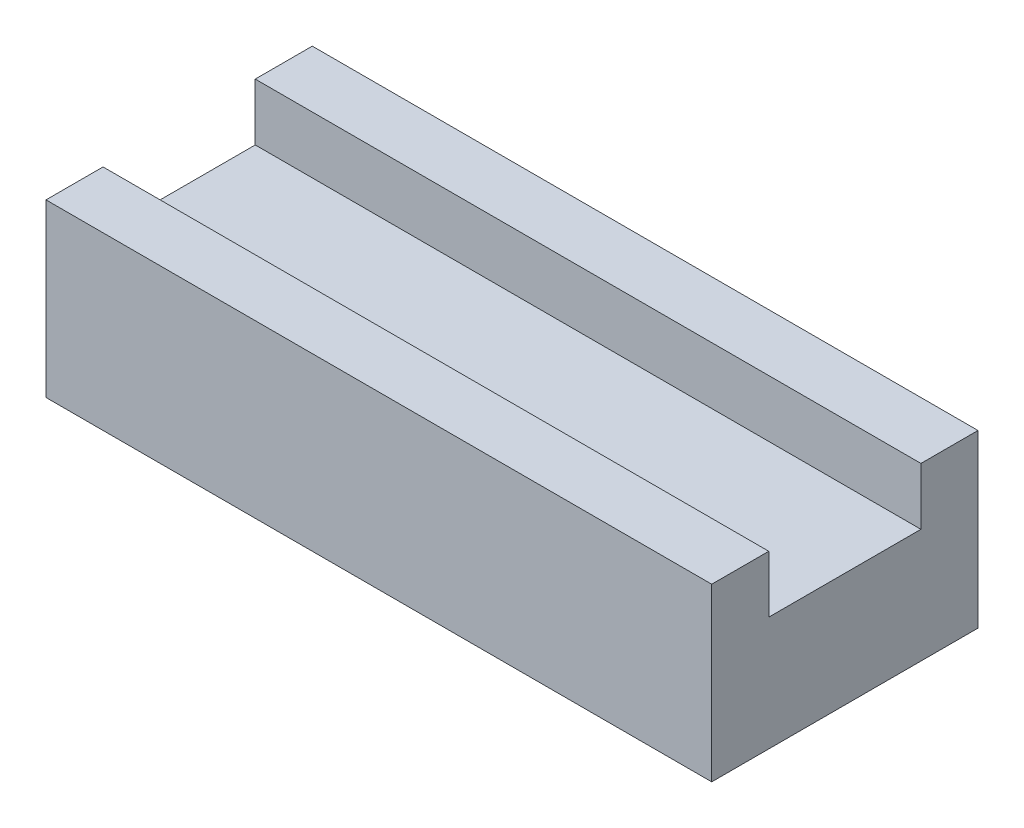
from build123d import *

# Parameters (mm, degrees)
BOSS_EXTRUDE1_DEPTH = 35


with BuildPart() as part:
    # Sketch1 → Boss-Extrude1 (new body)
    with BuildSketch(Plane(origin=(0, 0, 0), x_dir=(0, 0, -1), z_dir=(1, 0, 0))):
        Polygon((-7, 3), (-7, 6), (-4, 6), (-4, 3), (4, 3), (4, 6), (7, 6), (7, 3), (7, -3), (-7, -3), align=None)
    extrude(amount=-BOSS_EXTRUDE1_DEPTH)


solid = part.part
